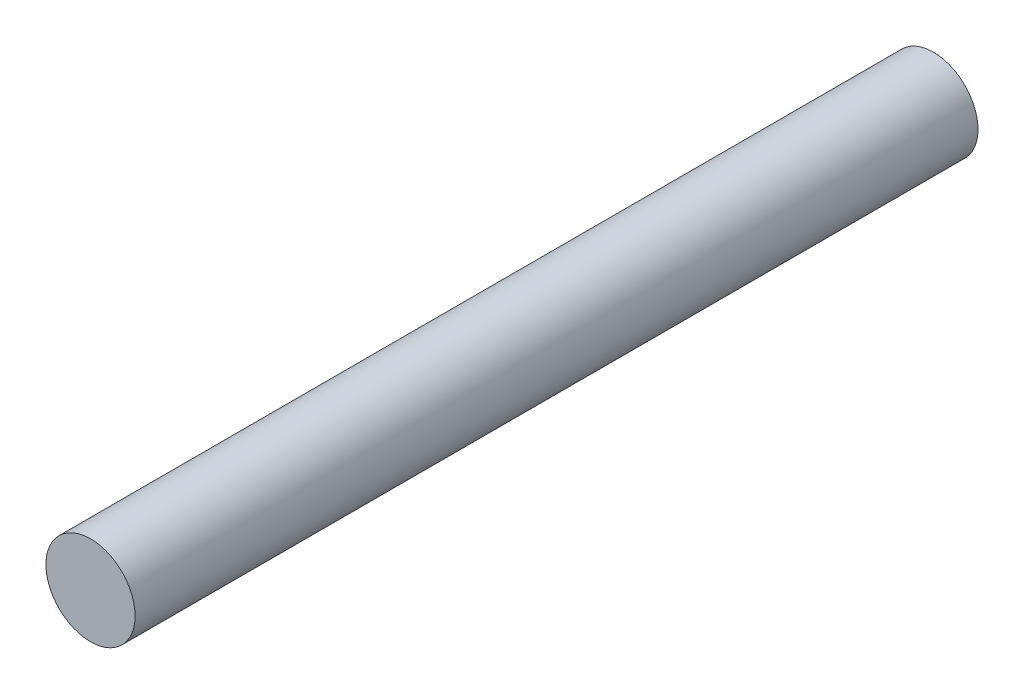
from build123d import *

# Parameters (mm, degrees)
SKETCH1_R           = 6.35
BOSS_EXTRUDE1_DEPTH = 120


with BuildPart() as part:
    # Sketch1 → Boss-Extrude1 (new body)
    with BuildSketch(Plane.XY):
        Circle(SKETCH1_R)
    extrude(amount=-BOSS_EXTRUDE1_DEPTH)


solid = part.part
